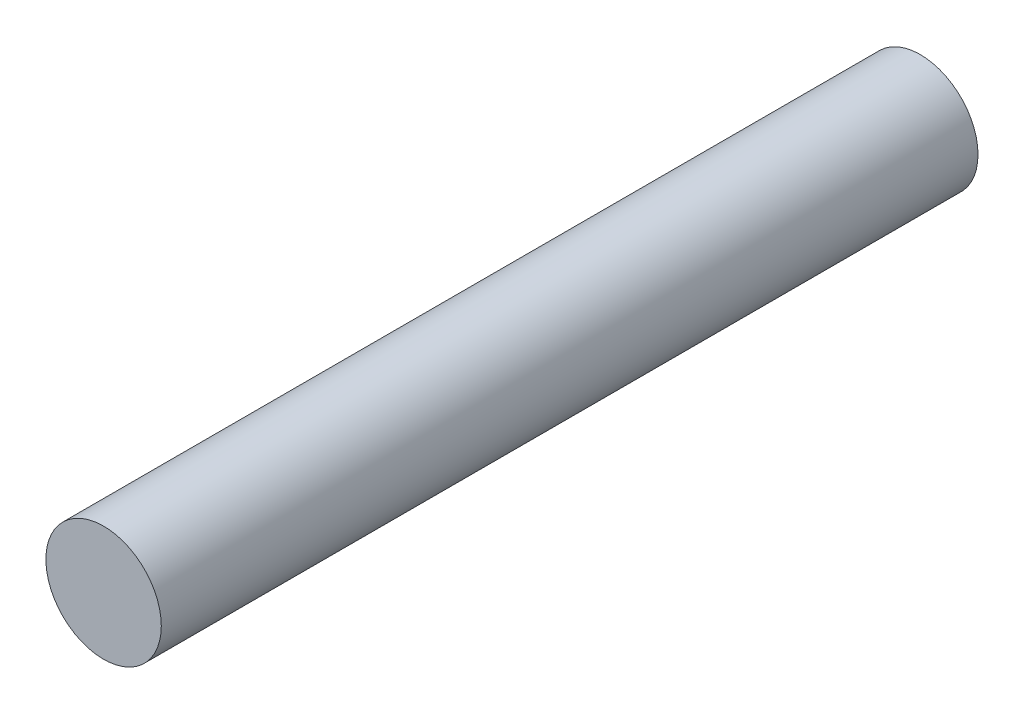
from build123d import *

# Parameters (mm, degrees)
BOSS_EXTRUDE1_DEPTH      = 292
BOSS_EXTRUDE1_DEPTH_BACK = 130
SKETCH1_R                = 29.815


with BuildPart() as part:
    # Sketch1 → Boss-Extrude1 (new, two sides: drawn at the far end of the back side and taken through both)
    with BuildSketch(Plane.XY.offset(-BOSS_EXTRUDE1_DEPTH_BACK)):
        Circle(SKETCH1_R)
    extrude(amount=BOSS_EXTRUDE1_DEPTH + BOSS_EXTRUDE1_DEPTH_BACK)


solid = part.part
